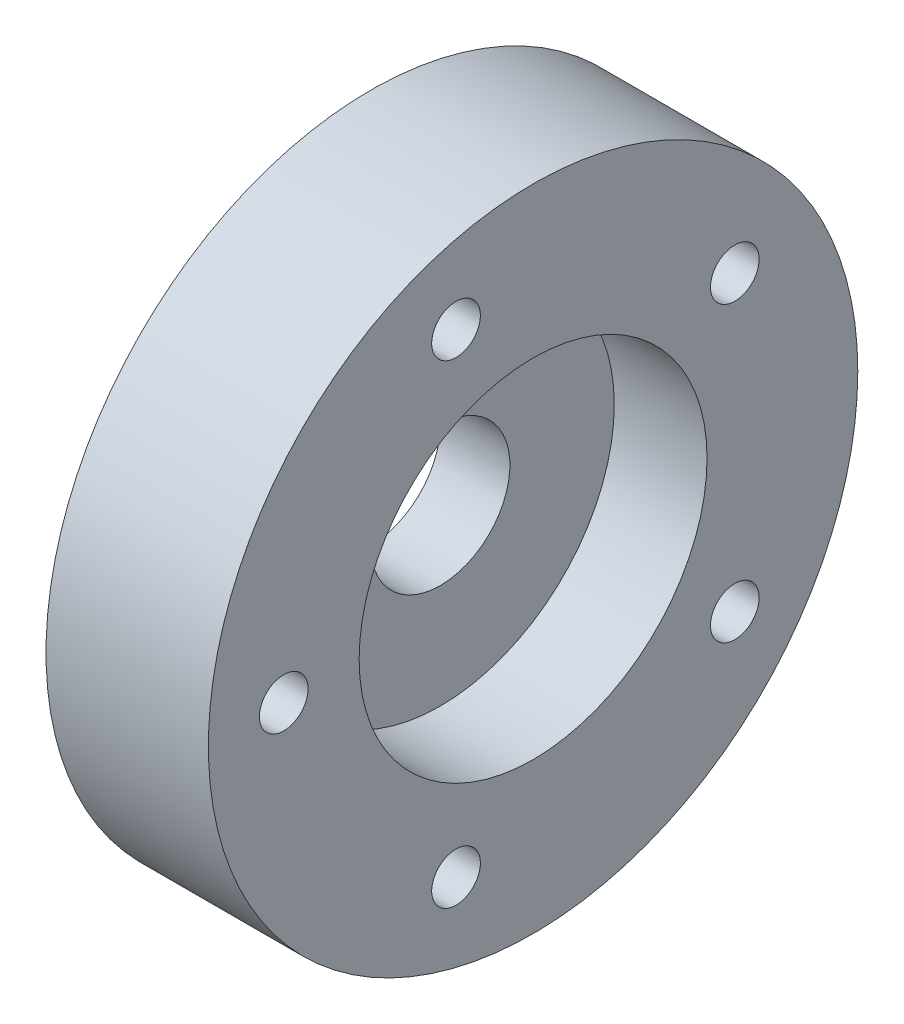
from build123d import *

# Parameters (mm, degrees)
SKETCH1_R                 = 28
BOSS_EXTRUDE1_DEPTH       = 14
SKETCH2_R                 = 15
CUT_EXTRUDE1_DEPTH        = 8
CUT_EXTRUDE2_DEPTH        = 16
M5X0_8_TAPPED_HOLE1_D     = 4.2
M5X0_8_TAPPED_HOLE1_DEPTH = 8
M5X0_8_TAPPED_HOLE1_TIP   = 1.2618073


with BuildPart() as part:
    # Sketch1 → Boss-Extrude1 (new body)
    with BuildSketch(Plane.YZ):
        with Locations(Location((0, 0, 0), (0, 0, 270))):
            Circle(SKETCH1_R)
    extrude(amount=BOSS_EXTRUDE1_DEPTH)

    # Sketch2 → Cut-Extrude1 (cut)
    with BuildSketch(Plane.YZ.offset(14)):
        with Locations(Location((0, 0, 0), (0, 0, 270))):
            Circle(SKETCH2_R)
    extrude(amount=-CUT_EXTRUDE1_DEPTH, mode=Mode.SUBTRACT)

    # Sketch3 → Cut-Extrude2 (cut)
    with BuildSketch(Plane(origin=(0, 0, 0), x_dir=(0, -1, 0), z_dir=(-1, 0, 0))):
        with BuildLine():
            Line((-2, 7.5), (2, 7.5))
            Line((2, 7.5), (2, 5.656854249))
            ThreePointArc((2, 5.656854249), (0, -6), (-2, 5.656854249))
            Line((-2, 5.656854249), (-2, 7.5))
        make_face()
    extrude(amount=-CUT_EXTRUDE2_DEPTH, mode=Mode.SUBTRACT)

    # M5x0.8 Tapped Hole1
    with Locations(Plane(origin=(14, -20.4477151, 6.643865379), x_dir=(0, 0, 1), z_dir=(1, 0, 0))):
        with Locations((0, 0), (14.856134621, -20.4477151), (-24.037730758, -7.810332176), (-24.037730758, -33.085098024), (0, -40.8954302)):
            Hole(M5X0_8_TAPPED_HOLE1_D / 2, depth=M5X0_8_TAPPED_HOLE1_DEPTH)
            with Locations((0, 0, -(M5X0_8_TAPPED_HOLE1_DEPTH + M5X0_8_TAPPED_HOLE1_TIP / 2))):  # 118° drill point
                Cone(0, M5X0_8_TAPPED_HOLE1_D / 2, M5X0_8_TAPPED_HOLE1_TIP, mode=Mode.SUBTRACT)


solid = part.part
